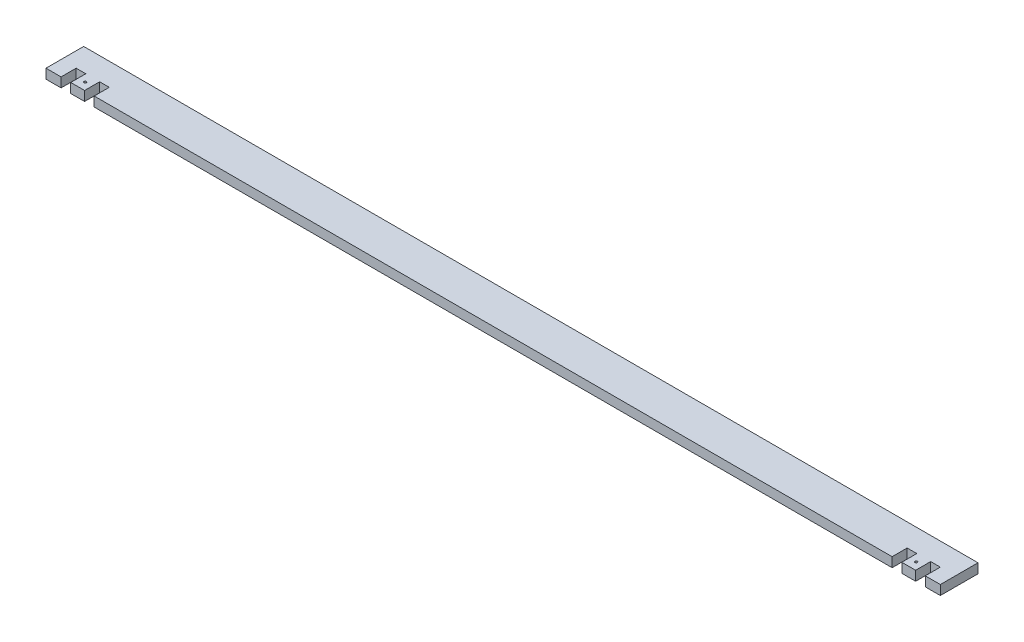
from build123d import *

# Parameters (mm, degrees)
SKETCH1_R           = 0.75
BOSS_EXTRUDE1_DEPTH = 6.35


with BuildPart() as part:
    # Sketch1 → Boss-Extrude1 (new body)
    with BuildSketch(Plane(origin=(0, 0, 0), x_dir=(1, 0, 0), z_dir=(0, 1, 0))):
        Polygon((296.75, 12.5), (-296.75, 12.5), (-296.75, -12.5), (-286.75, -12.5), (-286.75, -2.5), (-280.35, -2.5), (-280.35, -12.5), (-271.15, -12.5), (-271.15, -2.5), (-264.75, -2.5), (-264.75, -12.5), (264.75, -12.5), (264.75, -2.5), (271.15, -2.5), (271.15, -12.5), (280.35, -12.5), (280.35, -2.5), (286.75, -2.5), (286.75, -12.5), (296.75, -12.5), align=None)
        with Locations(Location((-275.75, -7.5, 0), (0, 0, 270))):
            Circle(SKETCH1_R, mode=Mode.SUBTRACT)
        with Locations(Location((275.75, -7.5, 0), (0, 0, 270))):
            Circle(SKETCH1_R, mode=Mode.SUBTRACT)
    extrude(amount=BOSS_EXTRUDE1_DEPTH)


solid = part.part
